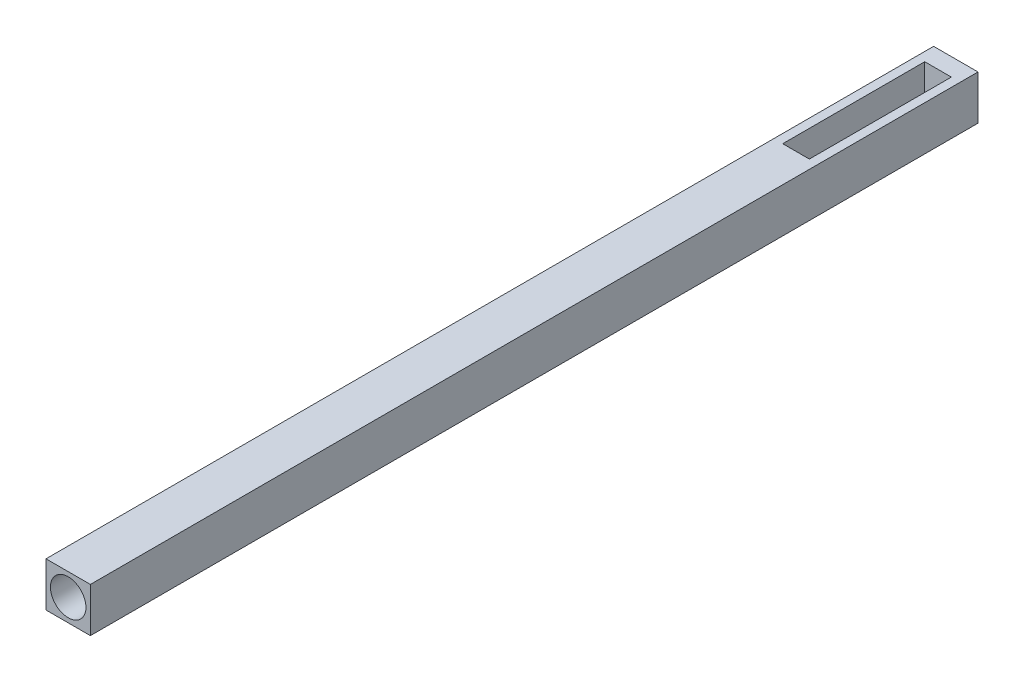
from build123d import *

# Parameters (mm, degrees)
SKETCH1_W           = 1.905
SKETCH1_H           = 10.16
BOSS_EXTRUDE2_DEPTH = 3.175
SKETCH2_R           = 1.27
CUT_EXTRUDE1_DEPTH  = 52.07


with BuildPart() as part:
    # Sketch1 → Boss-Extrude2 (new body)
    with BuildSketch(Plane(origin=(0, 0, 0), x_dir=(1, 0, 0), z_dir=(0, 1, 0))):
        Polygon((-1.5875, 25.4), (-1.5875, -25.4), (1.5875, -25.4), (1.5875, 25.4), (1.5875, 38.1), (-1.5875, 38.1), align=None)
        with Locations((0, 31.75)):
            Rectangle(SKETCH1_W, SKETCH1_H, mode=Mode.SUBTRACT)
    extrude(amount=BOSS_EXTRUDE2_DEPTH)

    # Sketch2 → Cut-Extrude1 (cut)
    with BuildSketch(Plane.XY.offset(25.4)):
        with Locations((0, 1.5875)):
            Circle(SKETCH2_R)
    extrude(amount=-CUT_EXTRUDE1_DEPTH, mode=Mode.SUBTRACT)


solid = part.part
